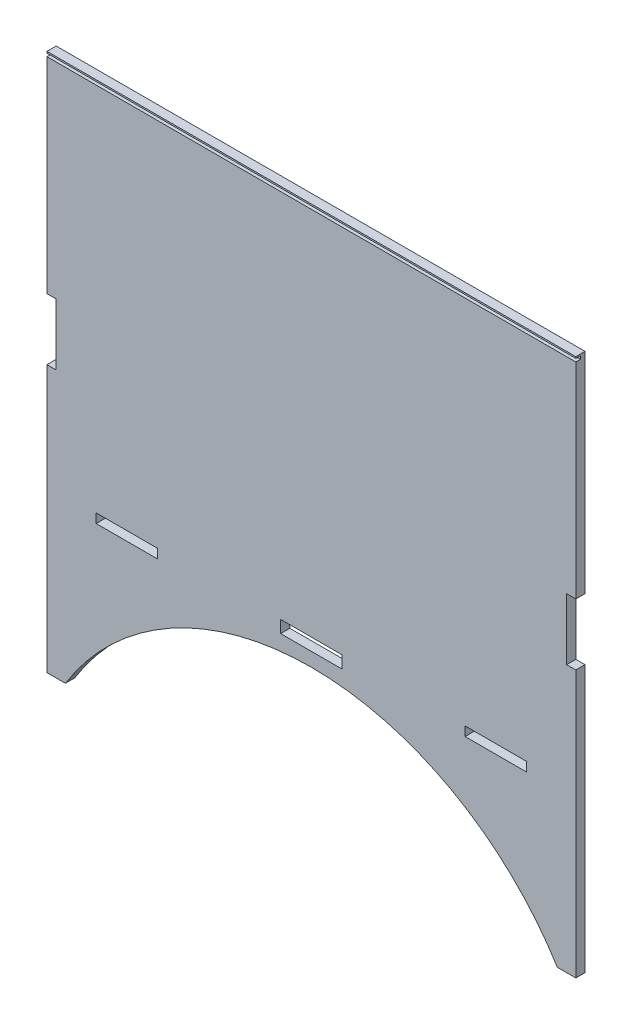
from build123d import *

# Parameters (mm, degrees)
ESQUISSE1_W             = 20
ESQUISSE1_H             = 3
ESQUISSE1_H_2           = 4
BOSS_EXTRU_1_DEPTH      = 3
ESQUISSE2_W             = 172
ESQUISSE2_H             = 1
ENL_V_MAT_EXTRU_1_DEPTH = 1.5
ESQUISSE4_W             = 3
ESQUISSE4_H             = 20
ENL_V_MAT_EXTRU_2_DEPTH = 207.455986147


with BuildPart() as part:
    # Esquisse1 → Boss.-Extru.1 (new body)
    with BuildSketch(Plane.XY):
        with BuildLine():
            Line((-109.499197329, 0), (62.500802671, 0))
            Line((62.500802671, 0), (62.500802671, -175))
            Line((62.500802671, -175), (56.500802671, -175))
            ThreePointArc((56.500802671, -175), (-23.499197329, -130.484780132), (-103.499197329, -175))
            Line((-103.499197329, -175), (-109.499197329, -175))
            Line((-109.499197329, -175), (-109.499197329, 0))
        make_face()
        with Locations((-83.499197329, -123.5)):
            Rectangle(ESQUISSE1_W, ESQUISSE1_H, mode=Mode.SUBTRACT)
        with Locations((-23.499197329, -124)):
            Rectangle(ESQUISSE1_W, ESQUISSE1_H_2, mode=Mode.SUBTRACT)
        with Locations((36.500802671, -123.5)):
            Rectangle(ESQUISSE1_W, ESQUISSE1_H, mode=Mode.SUBTRACT)
    extrude(amount=BOSS_EXTRU_1_DEPTH)

    # Esquisse2 → Enlèv. mat.-Extru.1 (cut)
    with BuildSketch(Plane.XY.offset(3)):
        with Locations((-23.499197329, -1)):
            Rectangle(ESQUISSE2_W, ESQUISSE2_H)
    extrude(amount=-ENL_V_MAT_EXTRU_1_DEPTH, mode=Mode.SUBTRACT)

    # Esquisse4 → Enlèv. mat.-Extru.2 (cut, through all)
    with BuildSketch(Plane.XY.offset(3)):
        with Locations((-107.999197329, -78.25)):
            Rectangle(ESQUISSE4_W, ESQUISSE4_H)
        with Locations((61.000802671, -78.25)):
            Rectangle(ESQUISSE4_W, ESQUISSE4_H)
    extrude(amount=-ENL_V_MAT_EXTRU_2_DEPTH, mode=Mode.SUBTRACT)


solid = part.part
